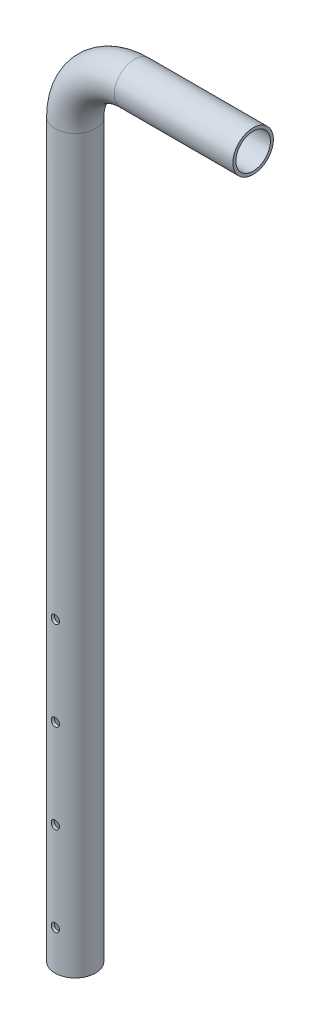
from build123d import *

# Parameters (mm, degrees)
ESBO_O2_R             = 10.25
ESBO_O2_R_2           = 8.75
FURO_ROSCADO_DE_M51_D = 4.2
PADR_O_LINEAR1_COUNT  = 4
PADR_O_LINEAR1_PITCH  = 45


with BuildPart() as part:
    # Varredura1: sweep along a path in Esboço1
    with BuildLine(Plane.XY) as varredura1_path:
        Line((0, 0), (0, 370))
        ThreePointArc((0, 370), (8.786796564, 391.213203436), (30, 400))
        Line((30, 400), (90, 400))
    # Esboço2 → Varredura1 (sweep)
    with BuildSketch(Plane(origin=(0, 0, 0), x_dir=(1, 0, 0), z_dir=(0, 1, 0))):
        Circle(ESBO_O2_R)
        Circle(ESBO_O2_R_2, mode=Mode.SUBTRACT)
    sweep(path=varredura1_path.line)

    # Furo roscado de M51 (through all)
    with Locations(Plane.XY.offset(11)):
        with Locations((0, 20)):
            furo_roscado_de_m51 = Hole(FURO_ROSCADO_DE_M51_D / 2)

    # Padrão linear1: Furo roscado de M51 ×4
    with Locations(*[(0, i * PADR_O_LINEAR1_PITCH, 0) for i in range(1, PADR_O_LINEAR1_COUNT)]):
        add(furo_roscado_de_m51, mode=Mode.SUBTRACT)


solid = part.part
